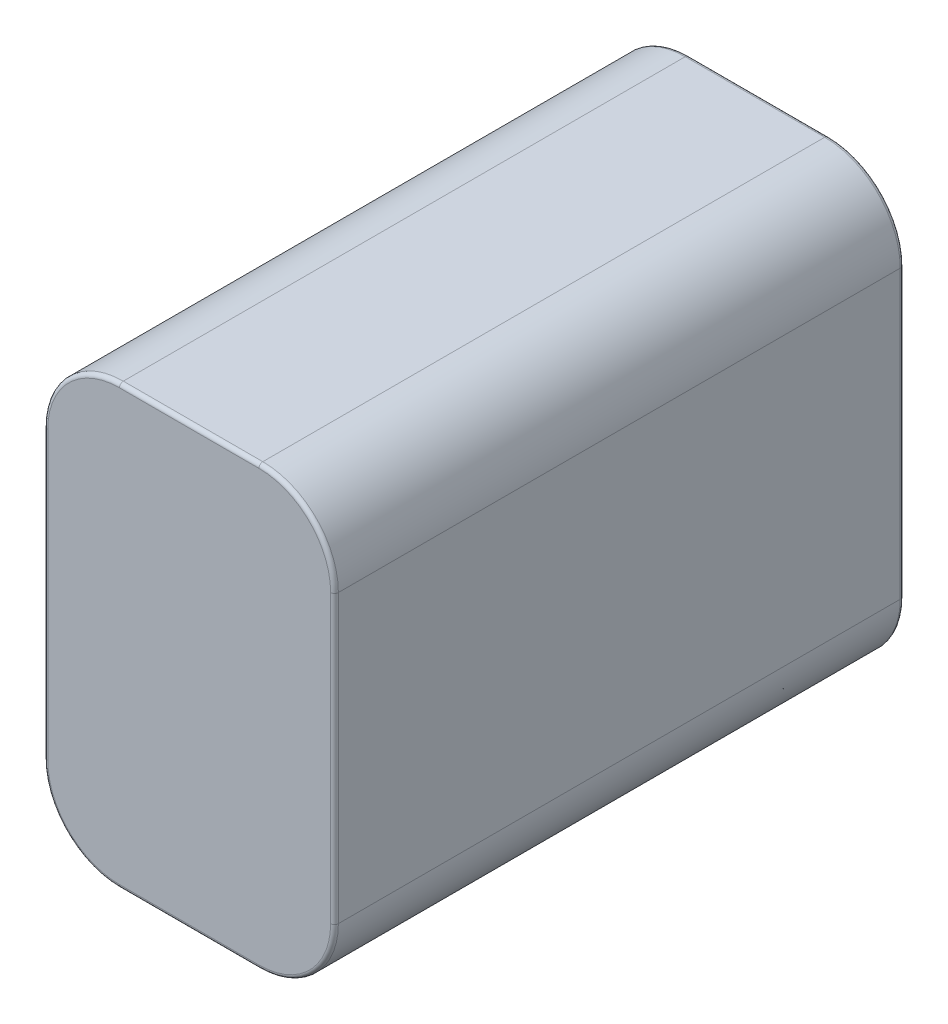
from build123d import *

# Parameters (mm, degrees)
BOSS_EXTRUDE1_DEPTH = 0.75
BOSS_EXTRUDE2_START = 65
BOSS_EXTRUDE2_DEPTH = 65
BOSS_EXTRUDE3_START = 7.75
BOSS_EXTRUDE3_DEPTH = 7.75
FILLET1_R           = 0.5


with BuildPart() as part:
    # Sketch1 → Boss-Extrude1 (new body)
    with BuildSketch(Plane.XY):
        with BuildLine():
            Line((0, -28.25), (18, -28.25))
            ThreePointArc((18, -28.25), (24.894291117, -25.394291117), (27.75, -18.5))
            Line((27.75, -18.5), (27.75, 18.5))
            ThreePointArc((27.75, 18.5), (24.894291117, 25.394291117), (18, 28.25))
            Line((18, 28.25), (0, 28.25))
            ThreePointArc((0, 28.25), (-6.894291117, 25.394291117), (-9.75, 18.5))
            Line((-9.75, 18.5), (-9.75, -18.5))
            ThreePointArc((-9.75, -18.5), (-6.894291117, -25.394291117), (0, -28.25))
        make_face()
    extrude(amount=BOSS_EXTRUDE1_DEPTH)

    # Sketch2 → Boss-Extrude2 (add)
    with BuildSketch(Plane(origin=(0, 0, 0), x_dir=(-1, 0, 0), z_dir=(0, 0, -1)).offset(BOSS_EXTRUDE2_START)):
        with BuildLine():
            Line((0, 28.25), (-18, 28.25))
            ThreePointArc((-18, 28.25), (-24.894291117, 25.394291117), (-27.75, 18.5))
            Line((-27.75, 18.5), (-27.75, -18.5))
            ThreePointArc((-27.75, -18.5), (-24.894291117, -25.394291117), (-18, -28.25))
            Line((-18, -28.25), (0, -28.25))
            ThreePointArc((0, -28.25), (6.894291117, -25.394291117), (9.75, -18.5))
            Line((9.75, -18.5), (9.75, 18.5))
            ThreePointArc((9.75, 18.5), (6.894291117, 25.394291117), (0, 28.25))
        make_face()
        with BuildLine():
            Line((-27, 18), (-27, -18))
            ThreePointArc((-27, -18), (-24.363961031, -24.363961031), (-18, -27))
            Line((-18, -27), (0, -27))
            ThreePointArc((0, -27), (6.363961031, -24.363961031), (9, -18))
            Line((9, -18), (9, 18))
            ThreePointArc((9, 18), (6.363961031, 24.363961031), (0, 27))
            Line((0, 27), (-18, 27))
            ThreePointArc((-18, 27), (-24.363961031, 24.363961031), (-27, 18))
        make_face(mode=Mode.SUBTRACT)
    extrude(amount=-BOSS_EXTRUDE2_DEPTH)

    # Sketch3 → Boss-Extrude3 (add)
    with BuildSketch(Plane(origin=(0, 0, -65), x_dir=(-1, 0, 0), z_dir=(0, 0, -1)).offset(BOSS_EXTRUDE3_START)):
        with BuildLine():
            Line((9.75, -18.5), (9.75, 18.5))
            ThreePointArc((9.75, 18.5), (6.894291117, 25.394291117), (0, 28.25))
            Line((0, 28.25), (-18, 28.25))
            ThreePointArc((-18, 28.25), (-24.894291117, 25.394291117), (-27.75, 18.5))
            Line((-27.75, 18.5), (-27.75, -18.5))
            ThreePointArc((-27.75, -18.5), (-24.894291117, -25.394291117), (-18, -28.25))
            Line((-18, -28.25), (0, -28.25))
            ThreePointArc((0, -28.25), (6.894291117, -25.394291117), (9.75, -18.5))
        make_face()
    extrude(amount=-BOSS_EXTRUDE3_DEPTH)

    # Fillet1
    fillet1_edges = [part.edges().sort_by_distance(p)[0] for p in [
        (-6.894291117, -25.394291117, 0.75),
        (9, -28.25, 0.75),
        (24.894291117, -25.394291117, 0.75),
        (27.75, 0, 0.75),
        (24.894291117, 25.394291117, 0.75),
        (9, 28.25, 0.75),
        (-6.894291117, 25.394291117, 0.75),
        (9, -28.25, -72.75),
        (-6.894291117, -25.394291117, -72.75),
        (-9.75, 0, -72.75),
        (-6.894291117, 25.394291117, -72.75),
        (9, 28.25, -72.75),
        (24.894291117, 25.394291117, -72.75),
        (27.75, 0, -72.75),
        (24.894291117, -25.394291117, -72.75),
        (-9.75, 0, 0.75),
    ]]
    fillet(fillet1_edges, radius=FILLET1_R)


solid = part.part
